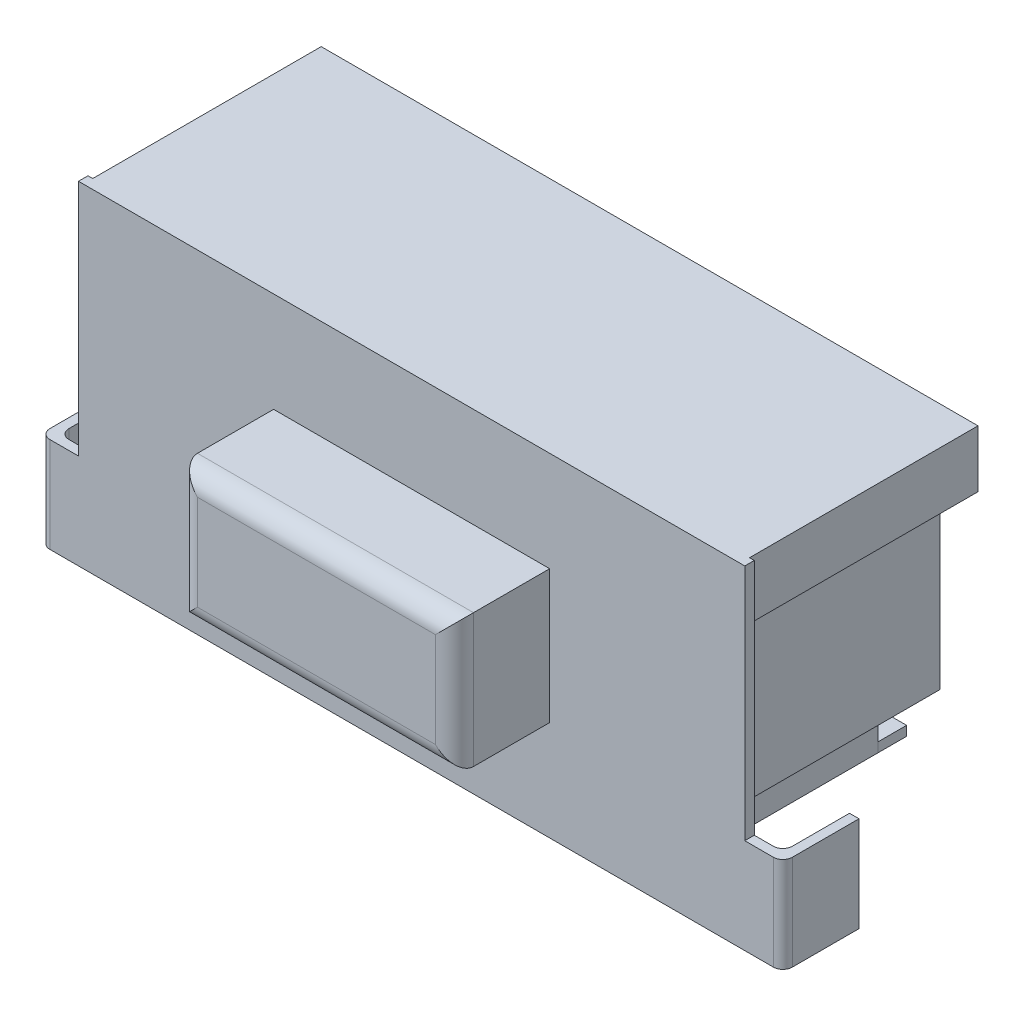
from build123d import *

# Parameters (mm, degrees)
EXTRUDE_1_DEPTH   = 2.5
EXTRUDE_2_DEPTH   = 0.1
SKETCH_3_W        = 0.1
SKETCH_3_H        = 1
EXTRUDE_3_DEPTH   = 0.8
FILLET_1_R        = 0.1
SKETCH_4_R        = 0.4
EXTRUDE_4_DEPTH   = 0.6
FILLET_2_R        = 0.2
SKETCH_5_W        = 0.6
SKETCH_5_H        = 0.6
EXTRUDE_5_DEPTH   = 0.1
EXTRUDE_5_2_DEPTH = 0.1
SKETCH_6_W        = 2.9
SKETCH_6_H        = 1.4
EXTRUDE_6_DEPTH   = 1
FILLET_3_R        = 0.2


with BuildPart() as part:
    # 스케치1 → 보스-돌출1 (new body)
    with BuildSketch(Plane.XY):
        Polygon((3.45, 2.9), (3.05, 2.9), (3.05, 0.9), (2.4, 0.9), (2.4, 0), (-2.4, 0), (-2.4, 0.9), (-3.05, 0.9), (-3.05, 2.9), (-3.45, 2.9), (-3.45, 3.5), (3.45, 3.5), align=None)
    extrude(amount=-EXTRUDE_1_DEPTH)

    # 스케치2 → 보스-돌출2 (add)
    with BuildSketch(Plane.XY):
        Polygon((-3.5, 1), (-3.5, 3.5), (3.5, 3.5), (3.5, 1), (3.9, 1), (3.9, 0), (-3.9, 0), (-3.9, 1), align=None)
    extrude(amount=-EXTRUDE_2_DEPTH)

    # 스케치3 → 보스-돌출3 (add)
    with BuildSketch(Plane.XY):
        with Locations((3.85, 0.5)):
            Rectangle(SKETCH_3_W, SKETCH_3_H)
        with Locations((-3.85, 0.5)):
            Rectangle(SKETCH_3_W, SKETCH_3_H)
    extrude(amount=-EXTRUDE_3_DEPTH)

    # 필렛1
    fillet_1_edges = [part.edges().sort_by_distance(p)[0] for p in [
        (3.9, 0.5, 0),
        (-3.9, 0.5, 0),
        (3.8, 0.5, -0.1),
        (-3.8, 0.5, -0.1),
    ]]
    fillet(fillet_1_edges, radius=FILLET_1_R)

    # 스케치4 → 보스-돌출4 (add)
    with BuildSketch(Plane(origin=(0, 0, 0), x_dir=(1, 0, 0), z_dir=(0, 1, 0))):
        with Locations(Location((-1.15, 1, 0), (0, 0, 270))):
            Circle(SKETCH_4_R)
        with Locations(Location((1.15, 1, 0), (0, 0, 270))):
            Circle(SKETCH_4_R)
    extrude(amount=-EXTRUDE_4_DEPTH)

    # 필렛2
    fillet_2_edges = [part.edges().sort_by_distance(p)[0] for p in [
        (-1.15, -0.6, -1.4),
        (1.15, -0.6, -1.4),
    ]]
    fillet(fillet_2_edges, radius=FILLET_2_R)

    # 스케치6 → 보스-돌출6 (add)
    with BuildSketch(Plane.XY):
        with Locations((0, 1.75)):
            Rectangle(SKETCH_6_W, SKETCH_6_H)
    extrude(amount=EXTRUDE_6_DEPTH)

    # 필렛3
    fillet_3_edges = [part.edges().sort_by_distance(p)[0] for p in [
        (-1.45, 1.75, 1),
        (0, 1.05, 1),
        (1.45, 1.75, 1),
        (0, 2.45, 1),
    ]]
    fillet(fillet_3_edges, radius=FILLET_3_R)


with BuildPart() as body_2:
    # 스케치5 → 보스-돌출5 (new body)
    with BuildSketch(Plane(origin=(0, 0, 0), x_dir=(1, 0, 0), z_dir=(0, 1, 0))):
        with Locations((-2.1, 2.5)):
            Rectangle(SKETCH_5_W, SKETCH_5_H)
    extrude(amount=EXTRUDE_5_DEPTH)


with BuildPart() as body_3:
    # 스케치5 → Extrude 5 2 (new body)
    with BuildSketch(Plane(origin=(0, 0, 0), x_dir=(1, 0, 0), z_dir=(0, 1, 0))):
        with Locations((2.1, 2.5)):
            Rectangle(SKETCH_5_W, SKETCH_5_H)
    extrude(amount=EXTRUDE_5_2_DEPTH)


solid = Compound([part.part, body_2.part, body_3.part])
